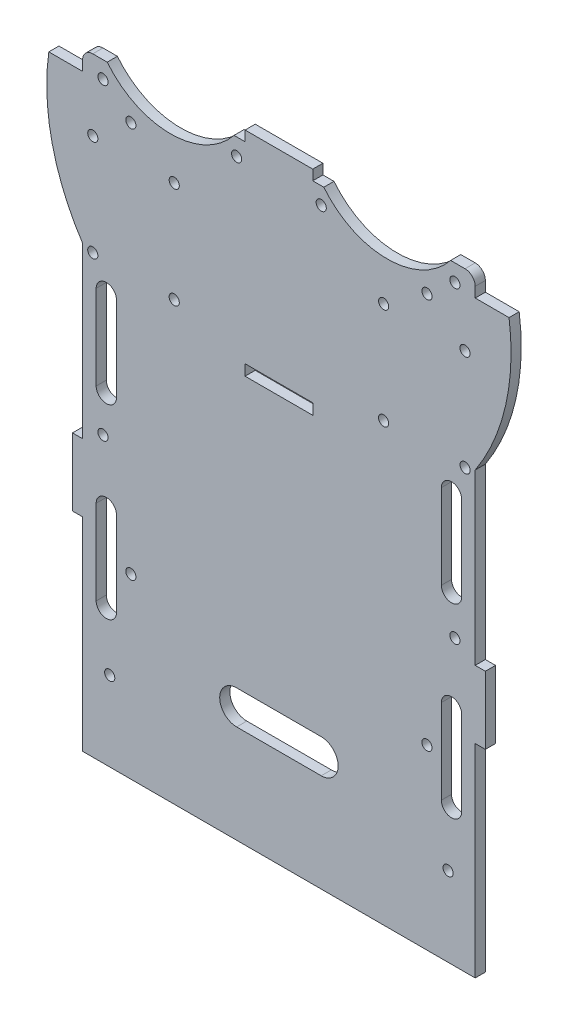
from build123d import *

# Parameters (mm, degrees)
SKETCH1_R           = 1.5
SKETCH1_W           = 20
SKETCH1_H           = 3.2
BOSS_EXTRUDE1_DEPTH = 3


with BuildPart() as part:
    # Sketch1 → Boss-Extrude1 (new body)
    with BuildSketch(Plane.XY):
        with BuildLine():
            Line((10, 120), (10, 123))
            Line((10, 123), (-10, 123))
            Line((-10, 123), (-10, 120))
            Line((-10, 120), (-13.265006005, 120))
            ThreePointArc((-13.265006005, 120), (-32, 111), (-50.734993995, 120))
            Line((-50.734993995, 120), (-55, 120))
            ThreePointArc((-55, 120), (-57.121320344, 119.121320344), (-58, 117))
            Line((-58, 117), (-58, 114))
            Line((-58, 114), (-68, 114))
            ThreePointArc((-68, 114), (-67.006266357, 91.089484919), (-58, 70))
            Line((-58, 70), (-58, 20))
            Line((-58, 20), (-61, 20))
            Line((-61, 20), (-61, 0))
            Line((-61, 0), (-58, 0))
            Line((-58, 0), (-58, -60))
            Line((-58, -60), (58, -60))
            Line((58, -60), (58, 0))
            Line((58, 0), (61, 0))
            Line((61, 0), (61, 20))
            Line((61, 20), (58, 20))
            Line((58, 20), (58, 70))
            ThreePointArc((58, 70), (67.006266357, 91.089484919), (68, 114))
            Line((68, 114), (58, 114))
            Line((58, 114), (58, 117))
            ThreePointArc((58, 117), (57.121320344, 119.121320344), (55, 120))
            Line((55, 120), (50.734993995, 120))
            ThreePointArc((50.734993995, 120), (32, 111), (13.265006005, 120))
            Line((13.265006005, 120), (10, 120))
        make_face()
        with Locations((-55, 99)):
            Circle(SKETCH1_R, mode=Mode.SUBTRACT)
        with Locations((-30.94, 99)):
            Circle(SKETCH1_R, mode=Mode.SUBTRACT)
        with Locations((-55, 69.11)):
            Circle(SKETCH1_R, mode=Mode.SUBTRACT)
        with Locations((-30.94, 69.11)):
            Circle(SKETCH1_R, mode=Mode.SUBTRACT)
        with Locations((30.94, 99)):
            Circle(SKETCH1_R, mode=Mode.SUBTRACT)
        with Locations((55, 99)):
            Circle(SKETCH1_R, mode=Mode.SUBTRACT)
        with Locations((30.94, 69.11)):
            Circle(SKETCH1_R, mode=Mode.SUBTRACT)
        with Locations((55, 69.11)):
            Circle(SKETCH1_R, mode=Mode.SUBTRACT)
        with Locations((-50, -36.5)):
            Circle(SKETCH1_R, mode=Mode.SUBTRACT)
        with Locations((50, -36.5)):
            Circle(SKETCH1_R, mode=Mode.SUBTRACT)
        with Locations((-12.5, 115)):
            Circle(SKETCH1_R, mode=Mode.SUBTRACT)
        with Locations((12.5, 115)):
            Circle(SKETCH1_R, mode=Mode.SUBTRACT)
        with Locations((-43.75, 108)):
            Circle(SKETCH1_R, mode=Mode.SUBTRACT)
        with Locations((43.75, 108)):
            Circle(SKETCH1_R, mode=Mode.SUBTRACT)
        with Locations((-43.75, -7.5)):
            Circle(SKETCH1_R, mode=Mode.SUBTRACT)
        with Locations((43.75, -7.5)):
            Circle(SKETCH1_R, mode=Mode.SUBTRACT)
        with Locations((-52, 24)):
            Circle(SKETCH1_R, mode=Mode.SUBTRACT)
        with Locations((52, 24)):
            Circle(SKETCH1_R, mode=Mode.SUBTRACT)
        with Locations((-52, 115)):
            Circle(SKETCH1_R, mode=Mode.SUBTRACT)
        with Locations((52, 115)):
            Circle(SKETCH1_R, mode=Mode.SUBTRACT)
        with Locations((0, 61.6)):
            Rectangle(SKETCH1_W, SKETCH1_H, mode=Mode.SUBTRACT)
        with BuildLine():
            Line((-48, 60.5), (-48, 35.5))
            ThreePointArc((-48, 35.5), (-51, 32.5), (-54, 35.5))
            Line((-54, 35.5), (-54, 60.5))
            ThreePointArc((-54, 60.5), (-51, 63.5), (-48, 60.5))
        make_face(mode=Mode.SUBTRACT)
        with BuildLine():
            Line((54, 60.5), (54, 35.5))
            ThreePointArc((54, 35.5), (51, 32.5), (48, 35.5))
            Line((48, 35.5), (48, 60.5))
            ThreePointArc((48, 60.5), (51, 63.5), (54, 60.5))
        make_face(mode=Mode.SUBTRACT)
        with BuildLine():
            Line((-48, 5.5), (-48, -19.5))
            ThreePointArc((-48, -19.5), (-51, -22.5), (-54, -19.5))
            Line((-54, -19.5), (-54, 5.5))
            ThreePointArc((-54, 5.5), (-51, 8.5), (-48, 5.5))
        make_face(mode=Mode.SUBTRACT)
        with BuildLine():
            Line((54, 5.5), (54, -19.5))
            ThreePointArc((54, -19.5), (51, -22.5), (48, -19.5))
            Line((48, -19.5), (48, 5.5))
            ThreePointArc((48, 5.5), (51, 8.5), (54, 5.5))
        make_face(mode=Mode.SUBTRACT)
        with BuildLine():
            Line((-12.5, -21), (12.5, -21))
            ThreePointArc((12.5, -21), (17.5, -26), (12.5, -31))
            Line((12.5, -31), (-12.5, -31))
            ThreePointArc((-12.5, -31), (-17.5, -26), (-12.5, -21))
        make_face(mode=Mode.SUBTRACT)
    extrude(amount=BOSS_EXTRUDE1_DEPTH)


solid = part.part
